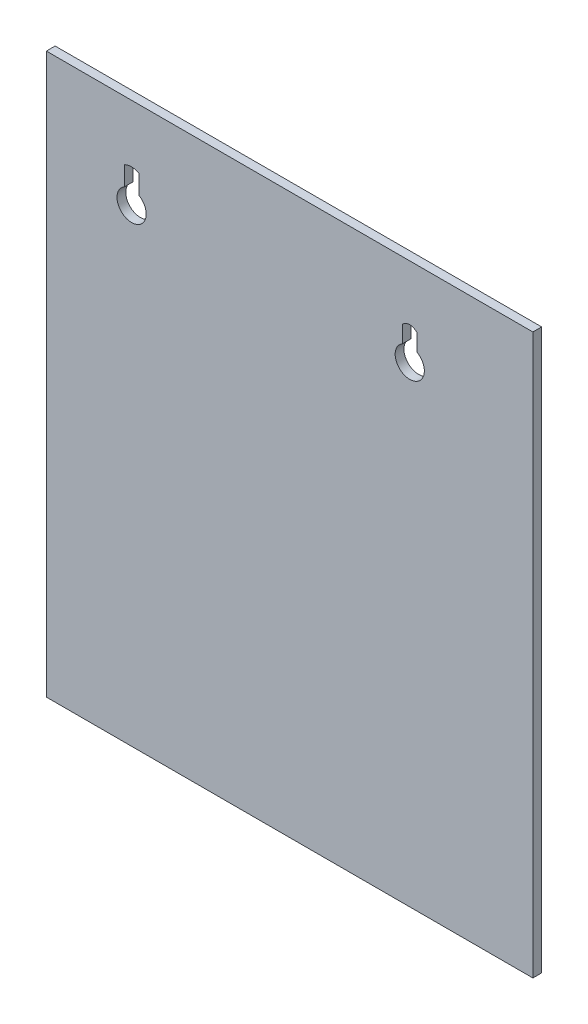
from build123d import *

# Parameters (mm, degrees)
IZIM1_W                     = 100
IZIM1_H                     = 115
Y_KSEKLIK_EKSTR_ZYON1_DEPTH = 1.8
KES_EKSTR_ZYON3_DEPTH       = 10
KES_EKSTR_ZYON5_DEPTH       = 10


with BuildPart() as part:
    # Çizim1 → Yükseklik-Ekstrüzyon1 (new body)
    with BuildSketch(Plane.XY):
        with Locations((1.04956231, -32.641643059)):
            Rectangle(IZIM1_W, IZIM1_H)
    extrude(amount=Y_KSEKLIK_EKSTR_ZYON1_DEPTH)

    # Çizim2 → Kes-Ekstrüzyon3 (cut)
    with BuildSketch(Plane.XY):
        with BuildLine():
            Line((-32.928401058, 8.690561448), (-32.928401058, 12.65398339))
            add(Edge.make_bspline(
                [(-32.928401058, 12.65398339), (-31.428401058, 13.345574781), (-29.928401058, 12.65398339)],
                knots=[0, 0, 0, 1, 1, 1], degree=2))
            Line((-29.928401058, 12.65398339), (-29.928401058, 8.690561448))
            ThreePointArc((-29.928401058, 8.690561448), (-31.428401058, 3.092485237), (-32.928401058, 8.690561448))
        make_face()
    extrude(amount=KES_EKSTR_ZYON3_DEPTH, mode=Mode.SUBTRACT)

    # Çizim4 → Kes-Ekstrüzyon5 (cut)
    with BuildSketch(Plane.XY.offset(1.8)):
        with BuildLine():
            Line((24.242256458, 9.355414165), (24.242256458, 12.856809752))
            add(Edge.make_bspline(
                [(24.242256458, 12.856809752), (25.742256458, 14.132745358), (27.242256458, 12.856809752)],
                knots=[0, 0, 0, 1, 1, 1], degree=2))
            Line((27.242256458, 12.856809752), (27.242256458, 9.355414165))
            ThreePointArc((27.242256458, 9.355414165), (25.742256458, 3.757337953), (24.242256458, 9.355414165))
        make_face()
    extrude(amount=-KES_EKSTR_ZYON5_DEPTH, mode=Mode.SUBTRACT)


solid = part.part
